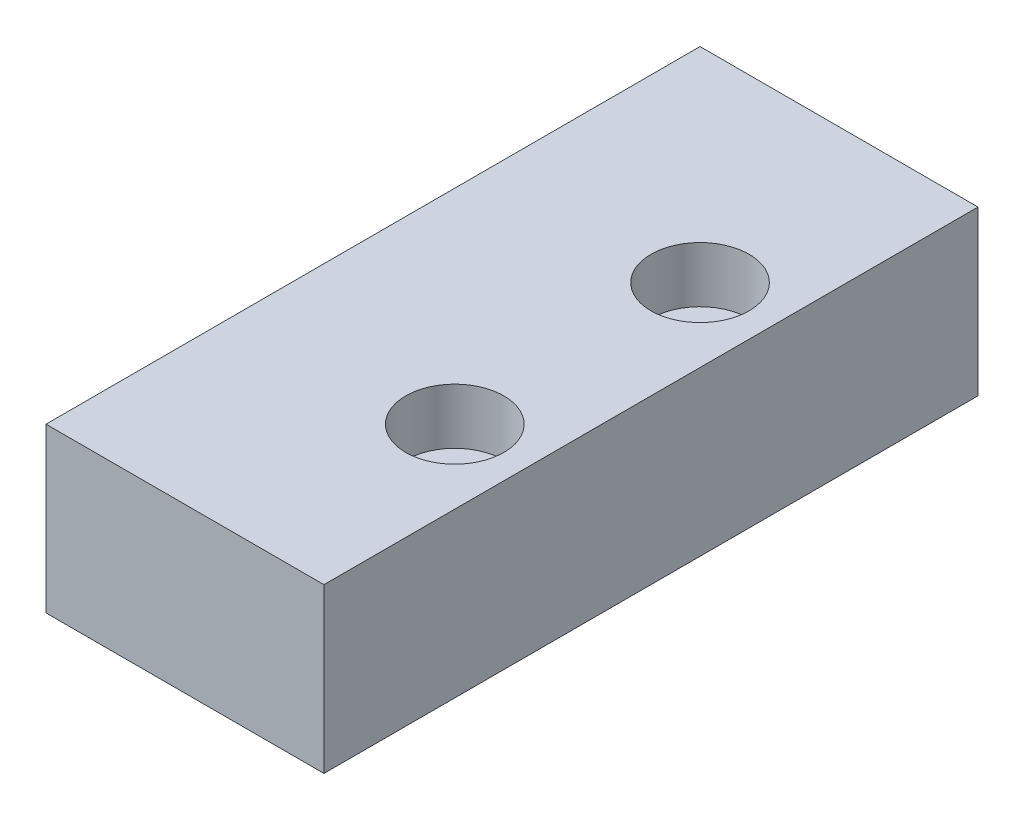
from build123d import *

# Parameters (mm, degrees)
EXTRUDE_1_DEPTH           = 10
HOLE_WIZARD_1_D           = 3.4
HOLE_WIZARD_1_CBORE_D     = 6
HOLE_WIZARD_1_CBORE_DEPTH = 3.4
HOLE_WIZARD_M3_2_D        = 2.5
HOLE_WIZARD_M3_2_DEPTH    = 7.5
HOLE_WIZARD_M3_2_TIP      = 0.751075774


with BuildPart() as part:
    # 草图1 → 凸台-拉伸1 (new body)
    with BuildSketch(Plane(origin=(0, 0, 0), x_dir=(1, 0, 0), z_dir=(0, 1, 0))):
        Polygon((0, 0), (0, 20), (-17, 20), (-17, -20), (0, -20), align=None)
    extrude(amount=EXTRUDE_1_DEPTH)

    # 打孔尺寸(%根据)内六角圆柱头螺钉的类型1 (through all)
    with Locations(Plane(origin=(-4.5, 10, -7.5), x_dir=(0, 0, 1), z_dir=(0, 1, 0))):
        with Locations((0, 0), (15, 0)):
            CounterBoreHole(HOLE_WIZARD_1_D / 2, HOLE_WIZARD_1_CBORE_D / 2, HOLE_WIZARD_1_CBORE_DEPTH)

    # M3 螺纹孔2
    with Locations(Plane(origin=(-17, 5, -12), x_dir=(0, 0, -1), z_dir=(-1, 0, 0))):
        with Locations((0, 0), (-12, 0), (-24, 0)):
            Hole(HOLE_WIZARD_M3_2_D / 2, depth=HOLE_WIZARD_M3_2_DEPTH)
            with Locations((0, 0, -(HOLE_WIZARD_M3_2_DEPTH + HOLE_WIZARD_M3_2_TIP / 2))):  # 118° drill point
                Cone(0, HOLE_WIZARD_M3_2_D / 2, HOLE_WIZARD_M3_2_TIP, mode=Mode.SUBTRACT)


solid = part.part
